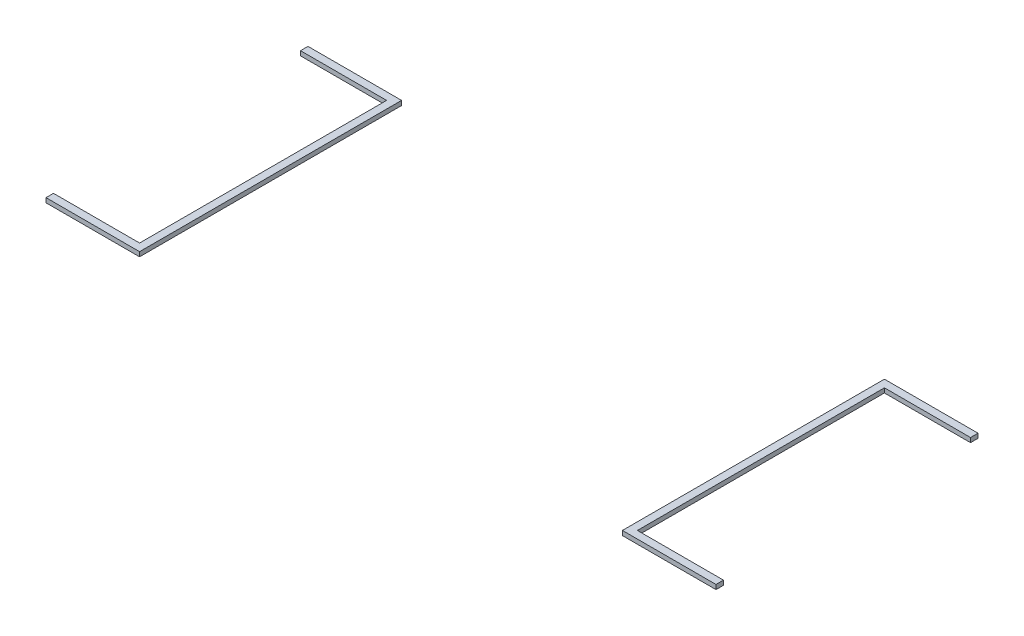
from build123d import *

# Parameters (mm, degrees)
EXTRUDE_1_DEPTH   = 12
EXTRUDE_1_2_DEPTH = 12


with BuildPart() as part:
    # Эскиз1 → Выдавливание1 (new body)
    with BuildSketch(Plane(origin=(0, 0, 0), x_dir=(-1, 0, 0), z_dir=(0, 1, 0))):
        Polygon((-895, -330), (-895, -350), (-645, -350), (-645, 350), (-895, 350), (-895, 330), (-665, 330), (-665, -330), align=None)
    extrude(amount=EXTRUDE_1_DEPTH)


with BuildPart() as body_2:
    # Эскиз1 → Extrude 1 2 (new body)
    with BuildSketch(Plane(origin=(0, 0, 0), x_dir=(-1, 0, 0), z_dir=(0, 1, 0))):
        Polygon((645, 350), (645, -350), (895, -350), (895, -330), (665, -330), (665, 330), (895, 330), (895, 350), align=None)
    extrude(amount=EXTRUDE_1_2_DEPTH)


solid = Compound([part.part, body_2.part])
